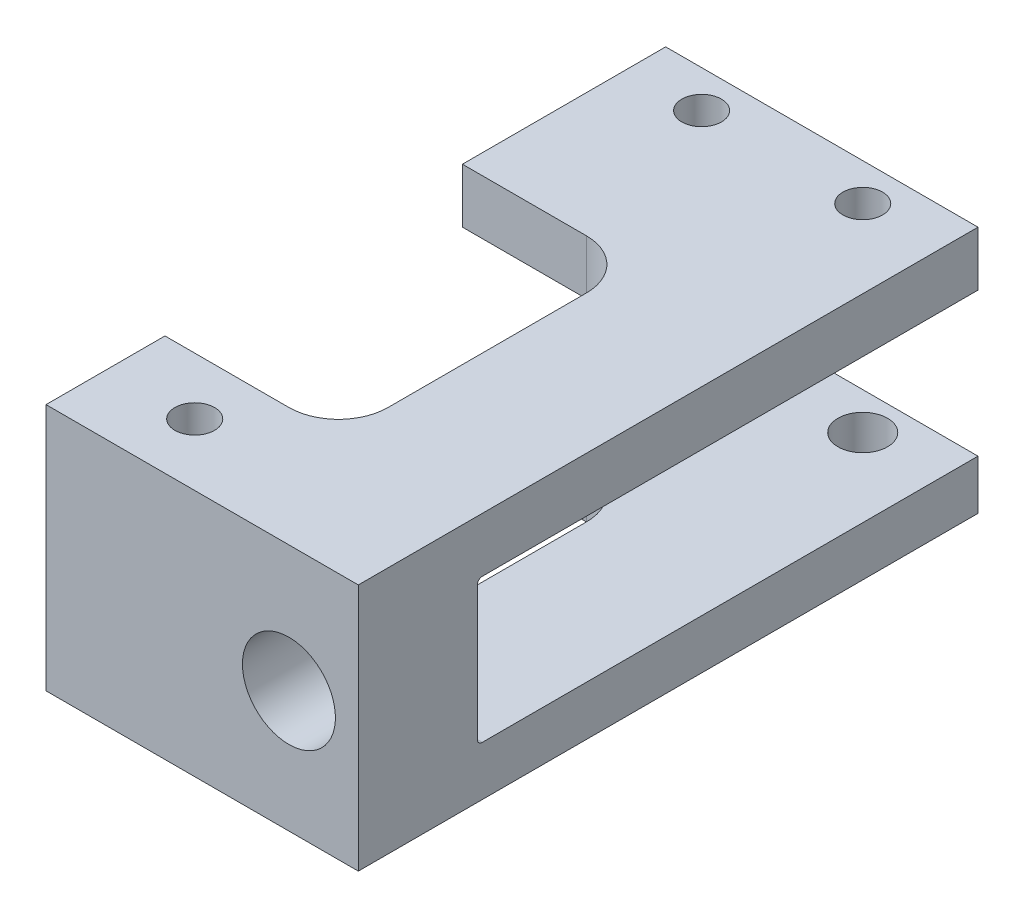
from build123d import *

# Parameters (mm, degrees)
SKETCH1_W                   = 12.6
SKETCH1_H                   = 25
BOSS_EXTRUDE1_DEPTH         = 10
CUT_EXTRUDE1_START          = -4.8
SKETCH2_W                   = 7
SKETCH2_H                   = 5.8
CUT_EXTRUDE1_DEPTH          = 23.853028767
SKETCH3_W                   = 20.2
SKETCH3_H                   = 5.8
CUT_EXTRUDE2_DEPTH          = 18.47140521
SKETCH6_R                   = 1
CUT_EXTRUDE5_DEPTH          = 17.122654868
TAP_DRILL_FOR_M2X0_4_TAP1_D = 1.6
CUT_EXTRUDE6_DEPTH          = 17.122654868
CUT_EXTRUDE6_DEPTH_BACK     = 17.122654868
SKETCH9_W                   = 7
SKETCH9_H                   = 12
FILLET1_R                   = 2
SKETCH4_R                   = 1.875
CUT_EXTRUDE7_DEPTH          = 24.403632197
TAP_DRILL_FOR_M2X0_4_TAP4_D = 1.6
FILLET3_R                   = 0.2


with BuildPart() as part:
    # Sketch1 → Boss-Extrude1 (new body)
    with BuildSketch(Plane(origin=(0, 0, 0), x_dir=(1, 0, 0), z_dir=(0, 1, 0))):
        Rectangle(SKETCH1_W, SKETCH1_H)
    extrude(amount=BOSS_EXTRUDE1_DEPTH)

    # Sketch2 → Cut-Extrude1 (cut, through all)
    with BuildSketch(Plane.XY.offset(12.5).offset(CUT_EXTRUDE1_START)):
        with Locations((-2.8, 4.9)):
            Rectangle(SKETCH2_W, SKETCH2_H)
    extrude(amount=-CUT_EXTRUDE1_DEPTH, mode=Mode.SUBTRACT)

    # Sketch3 → Cut-Extrude2 (cut, through all)
    with BuildSketch(Plane.ZY.offset(-0.7)):
        with Locations((-2.4, 4.9)):
            Rectangle(SKETCH3_W, SKETCH3_H)
    extrude(amount=-CUT_EXTRUDE2_DEPTH, mode=Mode.SUBTRACT)

    # Sketch6 → Cut-Extrude5 (cut, through all)
    with BuildSketch(Plane(origin=(0, 2, 0), x_dir=(1, 0, 0), z_dir=(0, 1, 0))):
        with Locations((3.15, 11)):
            Circle(SKETCH6_R)
        with Locations((-3.35, 11)):
            Circle(SKETCH6_R)
    extrude(amount=-CUT_EXTRUDE5_DEPTH, mode=Mode.SUBTRACT)

    # Tap Drill for M2x0.4 Tap1 (through all)
    with Locations(Plane(origin=(3.15, 10, -11), x_dir=(0, 0, 1), z_dir=(0, 1, 0))):
        with Locations((0, 0), (0, -6.5)):
            Hole(TAP_DRILL_FOR_M2X0_4_TAP1_D / 2)

    # Sketch9 → Cut-Extrude6 (cut, two sides: drawn at the far end of the back side and taken through both)
    with BuildSketch(Plane(origin=(0, 2, 0), x_dir=(1, 0, 0), z_dir=(0, 1, 0)).offset(-CUT_EXTRUDE6_DEPTH_BACK)):
        with Locations((-2.8, -1.7)):
            Rectangle(SKETCH9_W, SKETCH9_H)
    extrude(amount=CUT_EXTRUDE6_DEPTH + CUT_EXTRUDE6_DEPTH_BACK, mode=Mode.SUBTRACT)

    # Fillet1
    fillet1_edges = [part.edges().sort_by_distance(p)[0] for p in [
        (0.7, 1, -4.3),
        (0.7, 1, 7.7),
        (0.7, 8.9, -4.3),
        (0.7, 8.9, 7.7),
    ]]
    fillet(fillet1_edges, radius=FILLET1_R)

    # Sketch4 → Cut-Extrude7 (cut, through all)
    with BuildSketch(Plane(origin=(0, 0, 7.7), x_dir=(-1, 0, 0), z_dir=(0, 0, -1))):
        with Locations((-3.5, 4.9)):
            Circle(SKETCH4_R)
    extrude(amount=-CUT_EXTRUDE7_DEPTH, mode=Mode.SUBTRACT)

    # Tap Drill for M2x0.4 Tap4 (through all)
    with Locations(Plane(origin=(-2.8, 10, 10), x_dir=(0, 0, 1), z_dir=(0, 1, 0))):
        with Locations((0, 0)):
            Hole(TAP_DRILL_FOR_M2X0_4_TAP4_D / 2)

    # Fillet3
    fillet3_edges = [part.edges().sort_by_distance(p)[0] for p in [
        (2.5, 2, 7.7),
        (2.5, 7.8, 7.7),
    ]]
    fillet(fillet3_edges, radius=FILLET3_R)


solid = part.part
